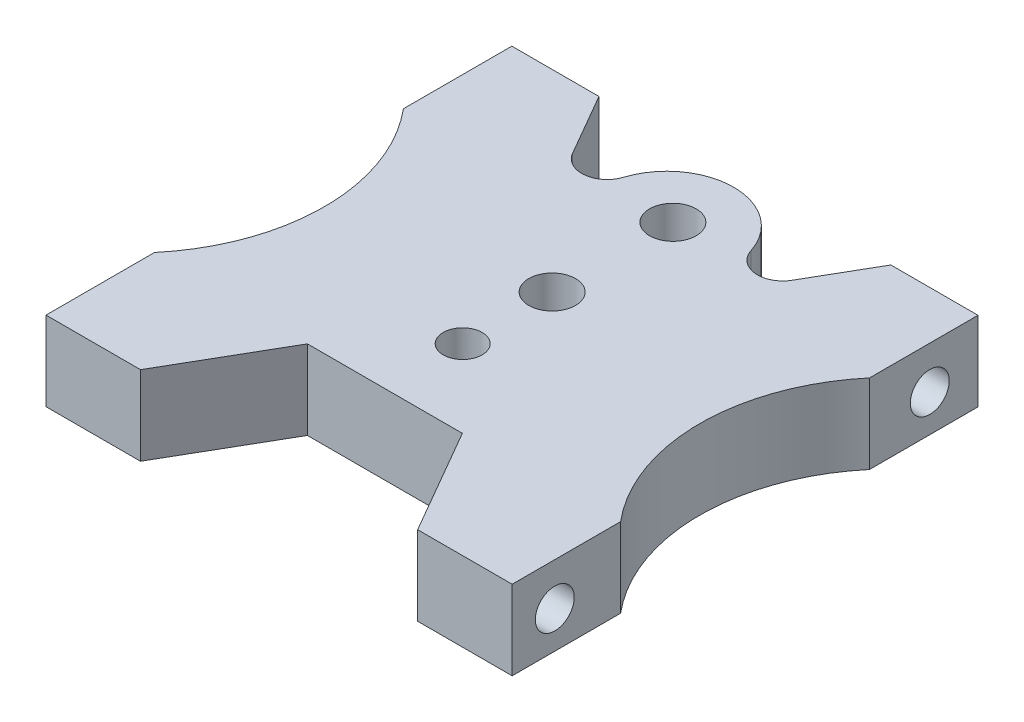
from build123d import *

# Parameters (mm, degrees)
SCHIZZO1_W                    = 29.96
SCHIZZO1_H                    = 29.94
ESTRUSIONE_ESTRUSIONE1_DEPTH  = 5.1
TAGLIO_ESTRUSIONE1_DEPTH      = 5.1
SCHIZZO3_R                    = 1.5
TAGLIO_ESTRUSIONE2_DEPTH      = 22.783280286
FORO_FILETTATO_M3X0_5_1_D     = 2.5
FORO_FILETTATO_M3X0_5_2_D     = 2.5
FORO_FILETTATO_M3X0_5_2_DEPTH = 10
FORO_FILETTATO_M3X0_5_2_TIP   = 0.751075774


with BuildPart() as part:
    # Schizzo1 → Estrusione-Estrusione1 (new body)
    with BuildSketch(Plane(origin=(0, 0, 0), x_dir=(1, 0, 0), z_dir=(0, 1, 0))):
        Rectangle(SCHIZZO1_W, SCHIZZO1_H)
    extrude(amount=-ESTRUSIONE_ESTRUSIONE1_DEPTH)

    # Schizzo2 → Taglio-Estrusione1 (cut)
    with BuildSketch(Plane(origin=(0, 0, 0), x_dir=(1, 0, 0), z_dir=(0, 1, 0))):
        Polygon((-4.98, -8.17), (-8.90598183, -14.97), (8.90598183, -14.97), (4.98, -8.17), align=None)
        with BuildLine():
            ThreePointArc((14.98, 8), (12.065, 0), (14.98, -8))
            Line((14.98, -8), (14.98, 8))
        make_face()
        with BuildLine():
            Line((9.38, 14.97), (-9.38, 14.97))
            Line((-9.38, 14.97), (-7.05655311, 10.945671938))
            ThreePointArc((-7.05655311, 10.945671938), (-5.469571784, 10.139327056), (-4.09, 11.264264161))
            ThreePointArc((-4.09, 11.264264161), (0, 14.25), (4.09, 11.264264161))
            ThreePointArc((4.09, 11.264264161), (5.469571784, 10.139327056), (7.05655311, 10.945671938))
            Line((7.05655311, 10.945671938), (9.38, 14.97))
        make_face()
        with BuildLine():
            Line((-14.98, 8), (-14.98, -8))
            ThreePointArc((-14.98, -8), (-12.065, 0), (-14.98, 8))
        make_face()
    extrude(amount=-TAGLIO_ESTRUSIONE1_DEPTH, mode=Mode.SUBTRACT)

    # Schizzo3 → Taglio-Estrusione2 (cut, through all)
    with BuildSketch(Plane(origin=(0, 0, 0), x_dir=(1, 0, 0), z_dir=(0, 1, 0))):
        with Locations(Location((0, 10.34, 0), (0, 0, 270))):
            Circle(SCHIZZO3_R)
        with Locations(Location((0, 2.58, 0), (0, 0, 270))):
            Circle(SCHIZZO3_R)
    extrude(amount=-TAGLIO_ESTRUSIONE2_DEPTH, mode=Mode.SUBTRACT)

    # Foro filettato M3x0.5-1 (through all)
    with Locations(Plane(origin=(0, 0, 0), x_dir=(1, 0, 0), z_dir=(0, 1, 0))):
        with Locations((0, -3.17)):
            Hole(FORO_FILETTATO_M3X0_5_1_D / 2)

    # Foro filettato M3x0.5-2
    with Locations(Plane(origin=(16.95, 0, 0), x_dir=(0, 0, -1), z_dir=(1, 0, 0))):
        with Locations((-12.23, -2.72), (11.87, -2.72)):
            Hole(FORO_FILETTATO_M3X0_5_2_D / 2, depth=FORO_FILETTATO_M3X0_5_2_DEPTH)
            with Locations((0, 0, -(FORO_FILETTATO_M3X0_5_2_DEPTH + FORO_FILETTATO_M3X0_5_2_TIP / 2))):  # 118° drill point
                Cone(0, FORO_FILETTATO_M3X0_5_2_D / 2, FORO_FILETTATO_M3X0_5_2_TIP, mode=Mode.SUBTRACT)


solid = part.part
